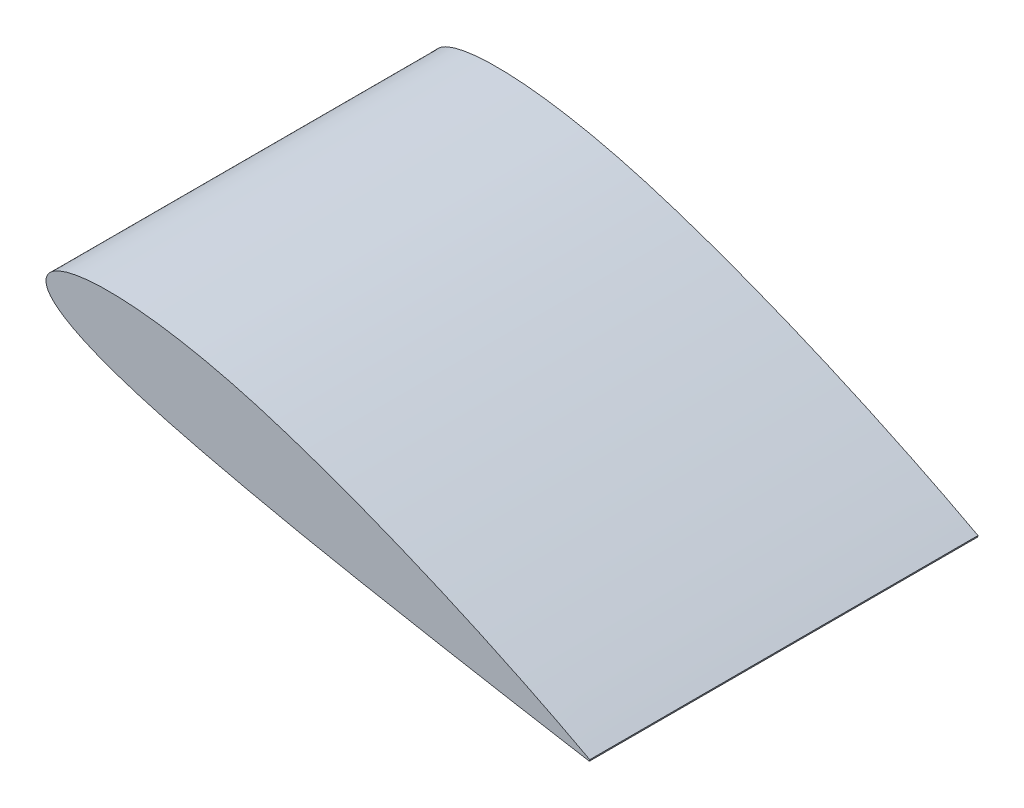
from build123d import *

# Parameters (mm, degrees)
DODANIE_WYCI_GNI_CIE2_DEPTH = 500


with BuildPart() as part:
    # Szkic1 → Dodanie-wyciągnięcie2 (new body)
    with BuildSketch(Plane.XY):
        with BuildLine():
            Line((699.902915977, -187.926757208), (699.351530357, -189.984556357))
            add(Edge.make_bspline(
                [(699.902915977, -187.926757208), (699.333794344, -187.615798785), (697.003057499, -186.342323642), (691.706465499, -183.566720524), (682.929518691, -178.927202269), (670.734635911, -172.587268295), (655.254514276, -164.637979222), (628.519237017, -151.188127115), (588.2382858, -131.604730885), (532.717659996, -105.991894715), (480.985396172, -83.604961711), (436.271200745, -65.350816584), (401.149264546, -51.618072887), (365.418441055, -38.368108411), (329.46047528, -25.788291003), (293.552968994, -14.052492944), (258.02588302, -3.550668836), (223.256407786, 5.437532488), (189.76819649, 12.79354843), (157.957614771, 18.436356413), (128.211696153, 22.363581301), (100.886653181, 24.55349314), (76.319368996, 25.109989559), (54.802006759, 24.100472846), (36.5732127, 21.673874283), (21.789123743, 17.94284728), (10.531470943, 12.995671842), (2.710123932, 6.711164746), (-1.054045771, -1.288507775), (-0.041143615, -10.05477163), (5.273634228, -18.501947253), (14.166400909, -26.818597556), (26.599158793, -35.243691626), (42.503003424, -43.739666751), (61.735229334, -52.248186084), (84.085575822, -60.722872746), (109.321844713, -69.100119929), (137.166605657, -77.355735148), (167.316492874, -85.495660826), (199.448997482, -93.508022464), (233.212008302, -101.433824974), (268.342246073, -109.334179404), (304.472681481, -117.172911095), (341.252306909, -124.725547977), (378.15025982, -132.008668483), (426.343219841, -141.27527826), (483.808360162, -151.937469492), (538.779300071, -161.918440968), (586.903551236, -170.503937686), (620.27728308, -176.405289666), (649.654019662, -181.496335843), (666.76236497, -184.450528708), (680.28772408, -186.753782535), (690.062017241, -188.419767077), (696.003010613, -189.402300451), (698.665758079, -189.865311141), (699.351530357, -189.984556357)],
                knots=[0, 0, 0, 0, 0.001308371, 0.005358201, 0.012063409, 0.021337301, 0.033086619, 0.047170643, 0.081714352, 0.123442225, 0.17051687, 0.195424313, 0.220875125, 0.246594093, 0.272301831, 0.297725323, 0.322799376, 0.347028843, 0.370161527, 0.391953614, 0.412187726, 0.430670139, 0.447230521, 0.461731545, 0.474085212, 0.484275747, 0.492391839, 0.498749378, 0.504100298, 0.509453028, 0.515789797, 0.523837666, 0.533884867, 0.546005347, 0.560170802, 0.576284399, 0.594211191, 0.613803379, 0.634869304, 0.657209967, 0.680611019, 0.704834652, 0.729852897, 0.755196951, 0.780582678, 0.805728554, 0.854204497, 0.898493683, 0.918442716, 0.95282566, 0.966867904, 0.978592199, 0.987851654, 0.994547444, 0.998595732, 1, 1, 1, 1], degree=3))
        make_face()
    extrude(amount=DODANIE_WYCI_GNI_CIE2_DEPTH)


solid = part.part
